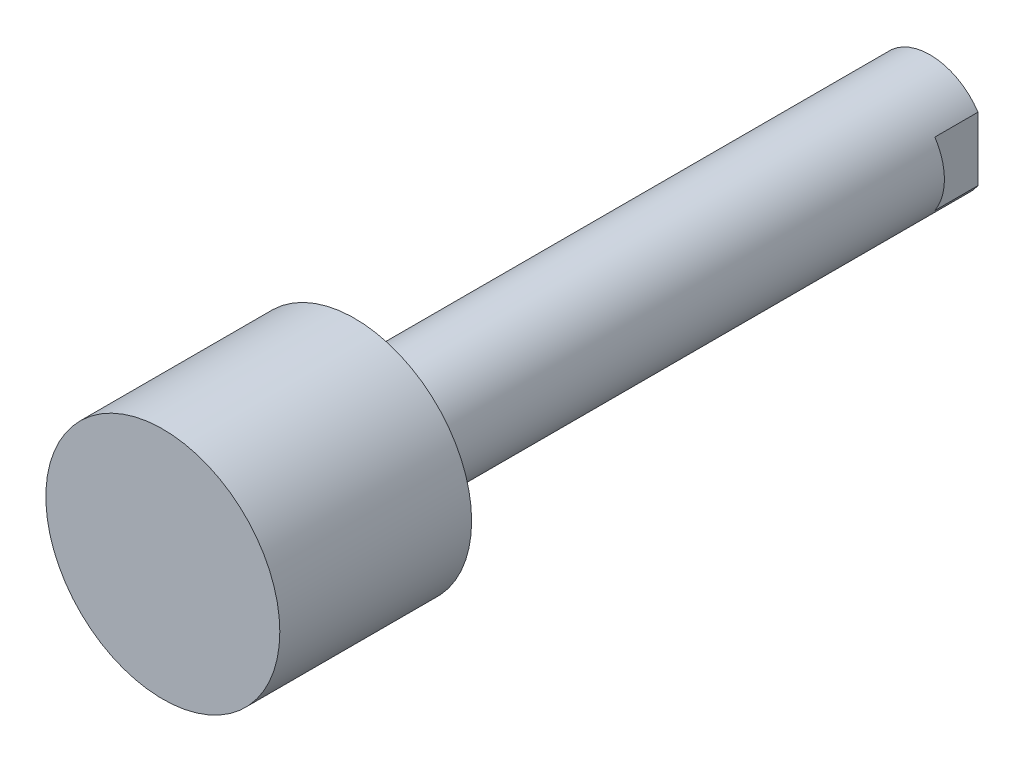
from build123d import *

# Parameters (mm, degrees)
SKETCH1_R                       = 3
BOSS_EXTRUDE1_DEPTH             = 30
SKETCH2_R                       = 6.099567635
BOSS_EXTRUDE2_DEPTH             = 10
CUT_EXTRUDE1_DEPTH              = 41.919548515
CUT_EXTRUDE1_DEPTH_BACK         = 41.919548515
SKETCH3_W                       = 2.43383409
SKETCH3_H                       = 2.25
SKETCH3_W_2                     = 2.704181163
TAP_DRILL_FOR_M3X0_5_TAP1_D     = 2.5
TAP_DRILL_FOR_M3X0_5_TAP1_DEPTH = 2.999994
TAP_DRILL_FOR_M3X0_5_TAP1_TIP   = 0.751075774


with BuildPart() as part:
    # Sketch1 → Boss-Extrude1 (new body)
    with BuildSketch(Plane.XY):
        Circle(SKETCH1_R)
    extrude(amount=BOSS_EXTRUDE1_DEPTH)

    # Sketch2 → Boss-Extrude2 (add)
    with BuildSketch(Plane.XY.offset(30)):
        Circle(SKETCH2_R)
    extrude(amount=BOSS_EXTRUDE2_DEPTH)

    # Sketch3 → Cut-Extrude1 (cut, two sides: drawn at the far end of the back side and taken through both)
    with BuildSketch(Plane(origin=(0, 0, 0), x_dir=(1, 0, 0), z_dir=(0, 1, 0)).offset(-CUT_EXTRUDE1_DEPTH_BACK)):
        with Locations((3.716917045, -1.125)):
            Rectangle(SKETCH3_W, SKETCH3_H)
        with Locations((-3.852090582, -1.125)):
            Rectangle(SKETCH3_W_2, SKETCH3_H)
    extrude(amount=CUT_EXTRUDE1_DEPTH + CUT_EXTRUDE1_DEPTH_BACK, mode=Mode.SUBTRACT)

    # Tap Drill for M3x0.5 Tap1
    with Locations(Plane(origin=(0, 0, 0), x_dir=(-1, 0, 0), z_dir=(0, 0, -1))):
        with Locations((0, 0)):
            Hole(TAP_DRILL_FOR_M3X0_5_TAP1_D / 2, depth=TAP_DRILL_FOR_M3X0_5_TAP1_DEPTH)
            with Locations((0, 0, -(TAP_DRILL_FOR_M3X0_5_TAP1_DEPTH + TAP_DRILL_FOR_M3X0_5_TAP1_TIP / 2))):  # 118° drill point
                Cone(0, TAP_DRILL_FOR_M3X0_5_TAP1_D / 2, TAP_DRILL_FOR_M3X0_5_TAP1_TIP, mode=Mode.SUBTRACT)


solid = part.part
